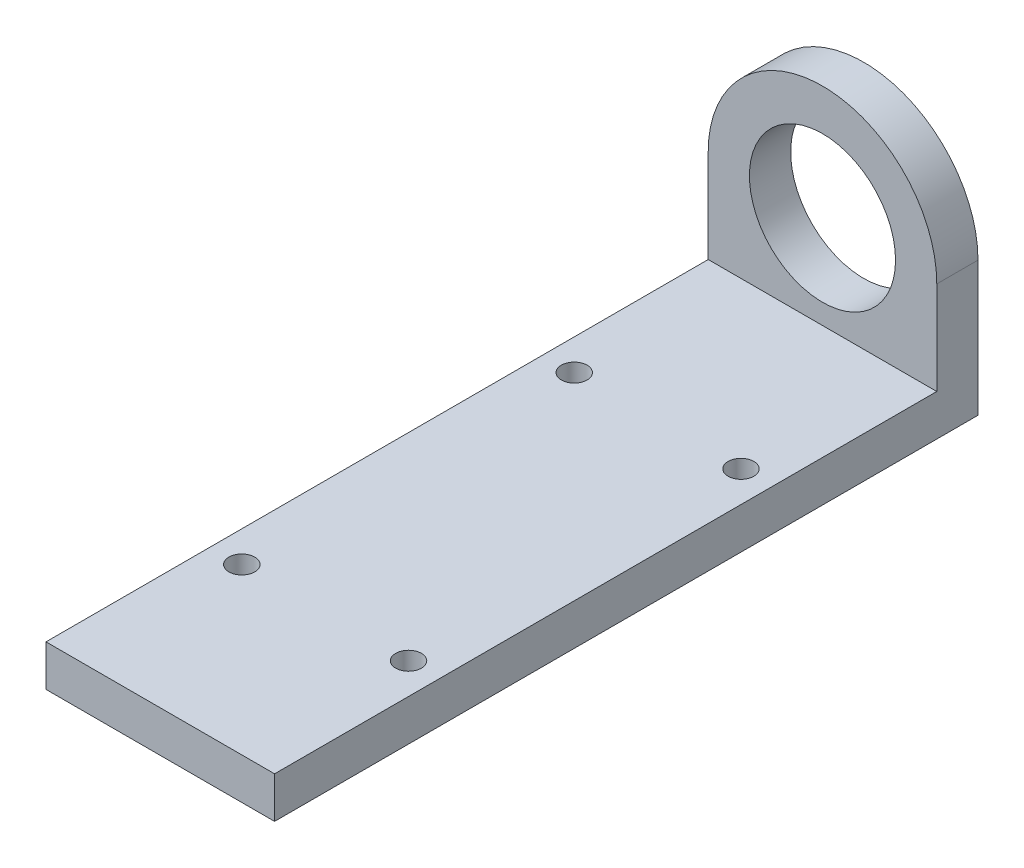
from build123d import *

# Parameters (mm, degrees)
SKETCH1_R           = 11.254
BOSS_EXTRUDE1_DEPTH = 6.35
SKETCH2_W           = 35.208
SKETCH2_H           = 6.35
BOSS_EXTRUDE2_DEPTH = 102
SKETCH3_R           = 1.984375
CUT_EXTRUDE1_DEPTH  = 115.327080921


with BuildPart() as part:
    # Sketch1 → Boss-Extrude1 (new body)
    with BuildSketch(Plane.XY):
        with BuildLine():
            Line((-17.604, 0), (-17.604, -20.7))
            Line((-17.604, -20.7), (17.604, -20.7))
            Line((17.604, -20.7), (17.604, 0))
            ThreePointArc((17.604, 0), (0, 17.604), (-17.604, 0))
        make_face()
        Circle(SKETCH1_R, mode=Mode.SUBTRACT)
    extrude(amount=BOSS_EXTRUDE1_DEPTH)

    # Sketch2 → Boss-Extrude2 (add)
    with BuildSketch(Plane.XY.offset(6.35)):
        with Locations((0, -17.525)):
            Rectangle(SKETCH2_W, SKETCH2_H)
    extrude(amount=BOSS_EXTRUDE2_DEPTH)

    # Sketch3 → Cut-Extrude1 (cut, through all)
    with BuildSketch(Plane(origin=(0, -14.35, 0), x_dir=(1, 0, 0), z_dir=(0, 1, 0))):
        with Locations(Location((12.8415, -31.75, 0), (0, 0, 270))):
            Circle(SKETCH3_R)
        with Locations(Location((12.8415, -82.95, 0), (0, 0, 270))):
            Circle(SKETCH3_R)
        with Locations(Location((-12.8415, -82.95, 0), (0, 0, 90))):
            Circle(SKETCH3_R)
        with Locations(Location((-12.8415, -31.75, 0), (0, 0, 90))):
            Circle(SKETCH3_R)
    extrude(amount=-CUT_EXTRUDE1_DEPTH, mode=Mode.SUBTRACT)


solid = part.part
